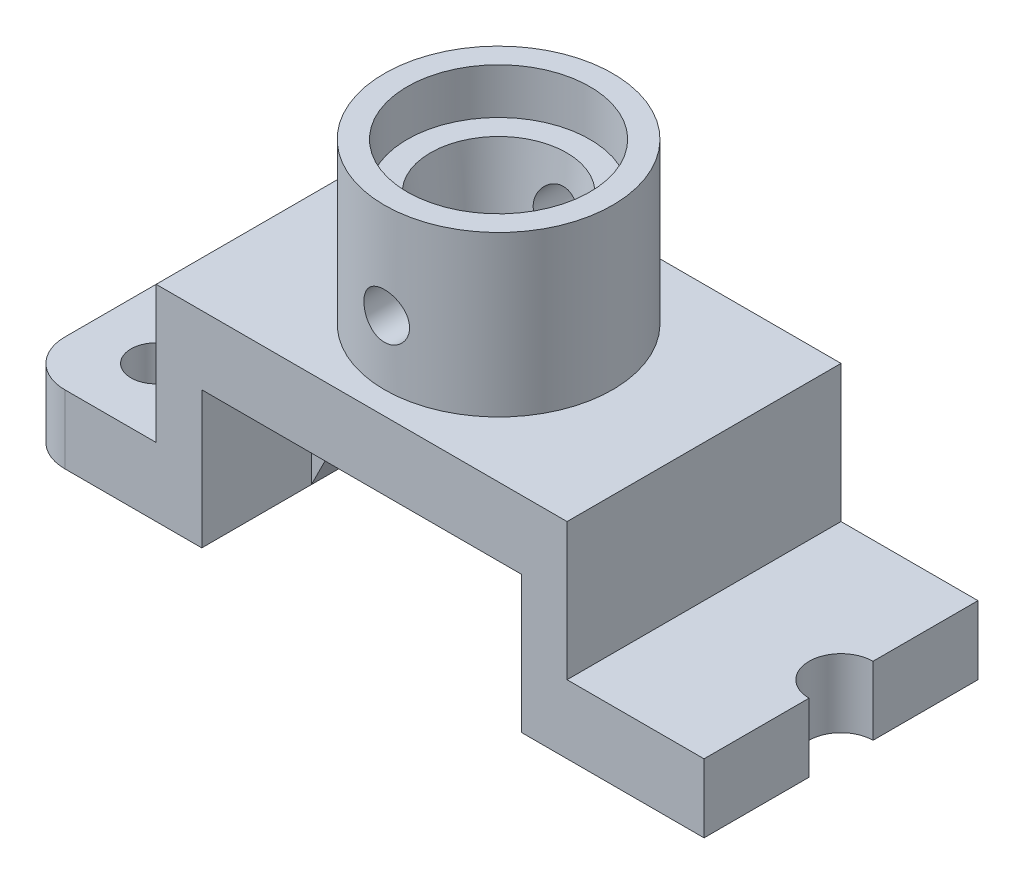
from build123d import *

# Parameters (mm, degrees)
BOSS_EXTRUDE1_DEPTH     = 30
BOSS_EXTRUDE2_DEPTH     = 6
SKETCH3_R               = 5.510010548
CUT_EXTRUDE1_DEPTH      = 87.168439698
FILLET1_R               = 10
SKETCH4_R               = 7
CUT_EXTRUDE2_DEPTH      = 42
SKETCH5_R               = 25
BOSS_EXTRUDE3_DEPTH     = 35
SKETCH6_R               = 20
CUT_EXTRUDE3_DEPTH      = 10
SKETCH8_R               = 10
CUT_EXTRUDE4_DEPTH      = 40
CUT_EXTRUDE4_DRAFT      = 7
CUT_EXTRUDE5_DEPTH      = 114.688170009
CUT_EXTRUDE5_DEPTH_BACK = 114.688170009
SKETCH9_R               = 5


with BuildPart() as part:
    # Sketch1 → Boss-Extrude1 (new, symmetric)
    with BuildSketch(Plane.XY):
        Polygon((-45, 15), (-75, 15), (-75, 0), (-35, 0), (-35, 30), (35, 30), (35, 0), (75, 0), (75, 15), (45, 15), (45, 45), (-45, 45), align=None)
    extrude(amount=BOSS_EXTRUDE1_DEPTH, both=True)

    # Sketch2 → Boss-Extrude2 (add, symmetric)
    with BuildSketch(Plane.XY):
        Polygon((20, 30), (35, 0), (35, 30), align=None)
        Polygon((-35, 0), (-20, 30), (-35, 30), align=None)
    extrude(amount=BOSS_EXTRUDE2_DEPTH, both=True)

    # Sketch3 → Cut-Extrude1 (cut, through all)
    with BuildSketch(Plane(origin=(0, 15, 0), x_dir=(1, 0, 0), z_dir=(0, 1, 0))):
        with Locations(Location((-60, 15, 0), (0, 0, 180))):
            Circle(SKETCH3_R)
        with Locations(Location((-60, -15, 0), (0, 0, 180))):
            Circle(SKETCH3_R)
    extrude(amount=-CUT_EXTRUDE1_DEPTH, mode=Mode.SUBTRACT)

    # Fillet1
    fillet1_edges = [part.edges().sort_by_distance(p)[0] for p in [
        (-75, 7.5, -30),
        (-75, 7.5, 30),
    ]]
    fillet(fillet1_edges, radius=FILLET1_R)

    # Sketch4 → Cut-Extrude2 (cut)
    with BuildSketch(Plane(origin=(0, 15, 0), x_dir=(1, 0, 0), z_dir=(0, 1, 0))):
        with Locations((75, 0)):
            Circle(SKETCH4_R)
    extrude(amount=-CUT_EXTRUDE2_DEPTH, mode=Mode.SUBTRACT)

    # Sketch5 → Boss-Extrude3 (add)
    with BuildSketch(Plane(origin=(0, 45, 0), x_dir=(1, 0, 0), z_dir=(0, 1, 0))):
        with Locations(Location((0, 0, 0), (0, 0, 270))):
            Circle(SKETCH5_R)
    extrude(amount=BOSS_EXTRUDE3_DEPTH)

    # Sketch6 → Cut-Extrude3 (cut)
    with BuildSketch(Plane(origin=(0, 80, 0), x_dir=(1, 0, 0), z_dir=(0, 1, 0))):
        with Locations(Location((0, 0, 0), (0, 0, 270))):
            Circle(SKETCH6_R)
    extrude(amount=-CUT_EXTRUDE3_DEPTH, mode=Mode.SUBTRACT)


with BuildPart() as cut_extrude4_tool:
    # Sketch8 → Cut-Extrude4 (with draft: the straight prism first)
    with BuildSketch(Plane.XZ.offset(-30)):
        Circle(SKETCH8_R)
    extrude(amount=-CUT_EXTRUDE4_DEPTH)
    # Cut-Extrude4: the draft: its side faces are tilted about the plane it starts from
    cut_extrude4_sides = [cut_extrude4_tool.faces().sort_by_distance(p)[0] for p in [
        (-10, 50, 0),
    ]]
    draft(cut_extrude4_sides, Plane.XZ.offset(-30), CUT_EXTRUDE4_DRAFT)


with BuildPart() as part_1:
    add(part.part)

    # Cut-Extrude4: cut by cut_extrude4_tool
    add(cut_extrude4_tool.part, mode=Mode.SUBTRACT)

    # Sketch9 → Cut-Extrude5 (cut, two sides: drawn at the far end of the back side and taken through both)
    with BuildSketch(Plane.XY.offset(-CUT_EXTRUDE5_DEPTH_BACK)):
        with Locations((0, 59)):
            Circle(SKETCH9_R)
    extrude(amount=CUT_EXTRUDE5_DEPTH + CUT_EXTRUDE5_DEPTH_BACK, mode=Mode.SUBTRACT)


solid = part_1.part
